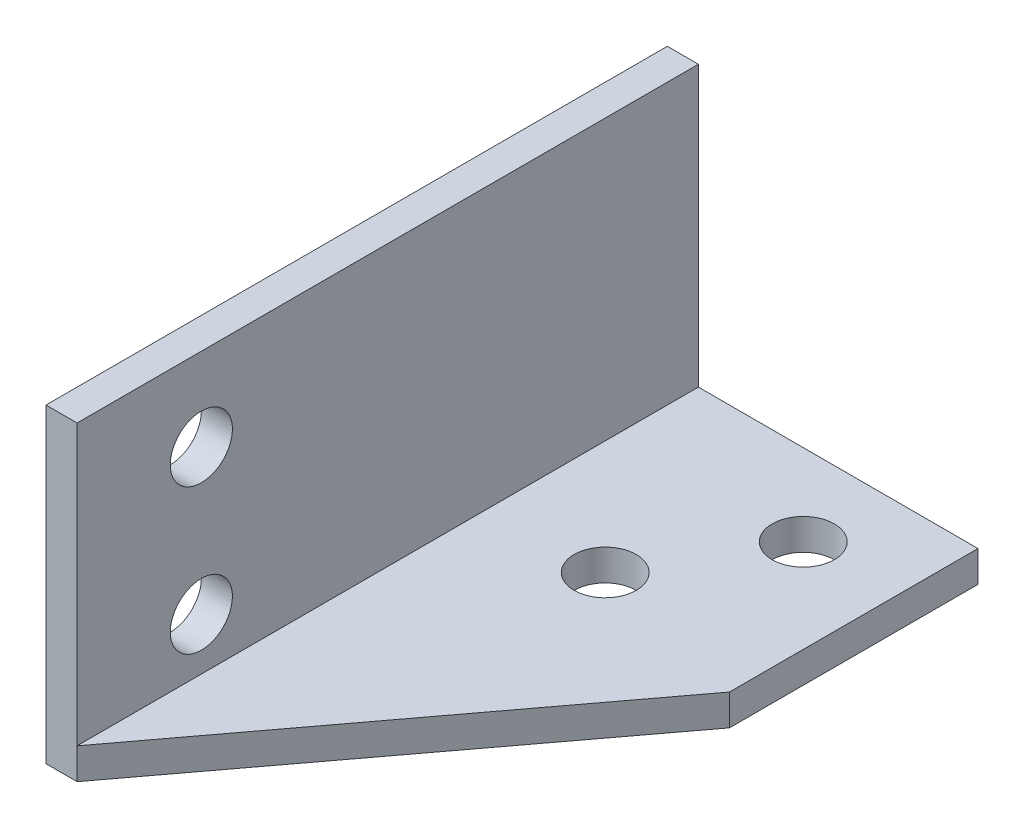
from build123d import *

# Parameters (mm, degrees)
EXTRUSION1_DEPTH = 30
ESQUISSE3_R      = 1.5
EXTRUSION2_DEPTH = 60
ESQUISSE4_R      = 1.5
EXTRUSION3_DEPTH = 60


with BuildPart() as part:
    # Esquisse1 → Extrusion1 (new body)
    with BuildSketch(Plane.XY):
        Polygon((-9.773002169, -6.59), (-8.273002169, -6.59), (-8.273002169, -20.09), (5.226997831, -20.09), (5.226997831, -21.59), (-9.773002169, -21.59), align=None)
    extrude(amount=EXTRUSION1_DEPTH)

    # Esquisse3 → Extrusion2 (cut)
    with BuildSketch(Plane(origin=(-8.273002169, 0, 0), x_dir=(0, 0, -1), z_dir=(1, 0, 0))):
        with Locations(Location((-24, -10.59, 0), (0, 0, 90))):
            Circle(ESQUISSE3_R)
        with Locations(Location((-24, -17.59, 0), (0, 0, 90))):
            Circle(ESQUISSE3_R)
    extrude(amount=-EXTRUSION2_DEPTH, mode=Mode.SUBTRACT)

    # Esquisse4 → Extrusion3 (cut)
    with BuildSketch(Plane(origin=(0, -20.09, 0), x_dir=(-1, 0, 0), z_dir=(0, 1, 0))):
        with Locations(Location((2.773002169, 10, 0), (0, 0, 90))):
            Circle(ESQUISSE4_R)
        with Locations(Location((-0.726997831, 3.937822174, 0), (0, 0, 90))):
            Circle(ESQUISSE4_R)
        Polygon((-5.226997831, 30), (8.273002169, 30), (-5.226997831, 12), align=None)
    extrude(amount=-EXTRUSION3_DEPTH, mode=Mode.SUBTRACT)


solid = part.part
